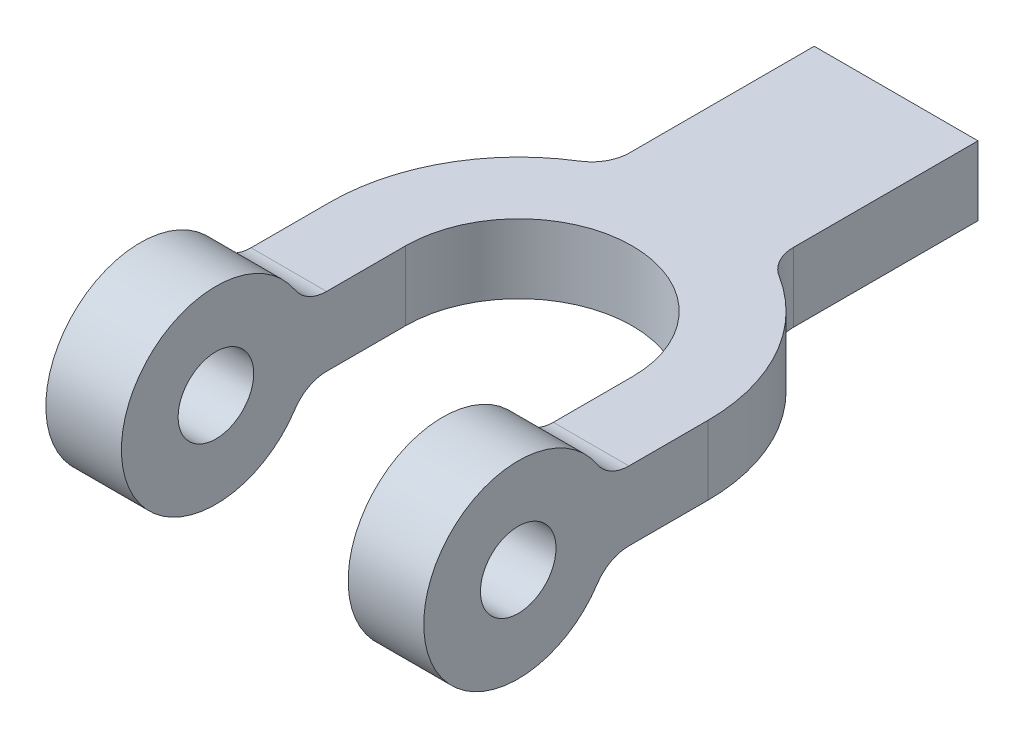
from build123d import *

# Parameters (mm, degrees)
SKETCH2_W           = 200
SKETCH2_H           = 350
BOSS_EXTRUDE1_DEPTH = 100
CUT_EXTRUDE3_DEPTH  = 226
SKETCH5_W           = 97.727308895
SKETCH5_H           = 31.680459025
CUT_EXTRUDE4_DEPTH  = 284.94541729
SCALE1_SCALE        = 0.35


with BuildPart() as part:
    # Sketch2 → Boss-Extrude1 (new body)
    with BuildSketch(Plane(origin=(0, 0, 0), x_dir=(1, 0, 0), z_dir=(0, 1, 0))):
        Rectangle(SKETCH2_W, SKETCH2_H)
    extrude(amount=BOSS_EXTRUDE1_DEPTH)

    # Sketch4 → Cut-Extrude3 (cut, through all)
    with BuildSketch(Plane(origin=(0, 100, 0), x_dir=(1, 0, 0), z_dir=(0, 1, 0))):
        with BuildLine():
            Line((100, 175), (43.347633031, 175))
            Line((43.347633031, 175), (43.347633031, 77.272691105))
            ThreePointArc((43.347633031, 77.272691105), (45.866803863, 67.555664213), (52.789694192, 60.286522394))
            ThreePointArc((52.789694192, 60.286522394), (87.404145859, 23.940813259), (100, -24.644321249))
            Line((100, -24.644321249), (100, 175))
        make_face()
        with BuildLine():
            Line((-43.347633031, 77.272691105), (-43.347633031, 175))
            Line((-43.347633031, 175), (-100, 175))
            Line((-100, 175), (-100, -24.644321206))
            ThreePointArc((-100, -24.644321206), (-87.404145849, 23.940813278), (-52.789694192, 60.286522394))
            ThreePointArc((-52.789694192, 60.286522394), (-45.866803863, 67.555664213), (-43.347633031, 77.272691105))
        make_face()
        with BuildLine():
            Line((60, -175), (60, -24.644321162))
            ThreePointArc((60, -24.644321162), (0, 35.355678838), (-60, -24.644321162))
            Line((-60, -24.644321162), (-60, -175))
            Line((-60, -175), (60, -175))
        make_face()
    extrude(amount=-CUT_EXTRUDE3_DEPTH, mode=Mode.SUBTRACT)

    # Sketch5 → Cut-Extrude4 (cut, through all)
    with BuildSketch(Plane(origin=(100, 0, 0), x_dir=(0, 0, -1), z_dir=(1, 0, 0))):
        with BuildLine():
            Line((-175, 100), (-175, 50))
            ThreePointArc((-175, 50), (-160.355339059, 85.355339059), (-125, 100))
            Line((-125, 100), (-175, 100))
        make_face()
        with BuildLine():
            ThreePointArc((-105, 50), (-125, 70), (-145, 50))
            Line((-145, 50), (-105, 50))
        make_face()
        with BuildLine():
            Line((-105, 50), (-145, 50))
            ThreePointArc((-145, 50), (-125, 30), (-105, 50))
        make_face()
        with BuildLine():
            ThreePointArc((-125, 0), (-160.355339059, 14.644660941), (-175, 50))
            Line((-175, 50), (-175, 0))
            Line((-175, 0), (-125, 0))
        make_face()
        with BuildLine():
            ThreePointArc((-83.15716493, 22.628899304), (-101.215078672, 6.019578022), (-125, 0))
            Line((-125, 0), (-24.644321162, 0))
            Line((-24.644321162, 0), (-24.644321162, 31.680459025))
            Line((-24.644321162, 31.680459025), (-66.420030902, 31.680459025))
            ThreePointArc((-66.420030902, 31.680459025), (-75.933999434, 29.272627817), (-83.15716493, 22.628899304))
        make_face()
        with BuildLine():
            Line((-124.644321162, 100), (-125, 100))
            ThreePointArc((-125, 100), (-101.215078672, 93.980421978), (-83.15716493, 77.371100696))
            ThreePointArc((-83.15716493, 77.371100696), (-75.933999434, 70.727372183), (-66.420030902, 68.319540975))
            Line((-66.420030902, 68.319540975), (-24.644321162, 68.319540975))
            Line((-24.644321162, 68.319540975), (-24.644321162, 100))
            Line((-24.644321162, 100), (-124.644321162, 100))
        make_face()
        Polygon((60.286522394, 100), (-24.644321162, 100), (-24.644321162, 68.319540975), (77.272691105, 68.319540975), (77.272691105, 100), align=None)
        Polygon((-24.644321162, 31.680459025), (-24.644321162, 0), (60.286522394, 0), (77.272691105, 0), (77.272691105, 31.680459025), align=None)
        with Locations((126.136345553, 15.840229513)):
            Rectangle(SKETCH5_W, SKETCH5_H)
        with Locations((126.136345553, 84.159770487)):
            Rectangle(SKETCH5_W, SKETCH5_H)
    extrude(amount=-CUT_EXTRUDE4_DEPTH, mode=Mode.SUBTRACT)


with BuildPart() as part_1:
    # Scale1: scaled about (0, 50, 16.903782196)
    add(part.part.scale(SCALE1_SCALE).moved(Location((0, 32.5, 10.987458427))))


solid = part_1.part
